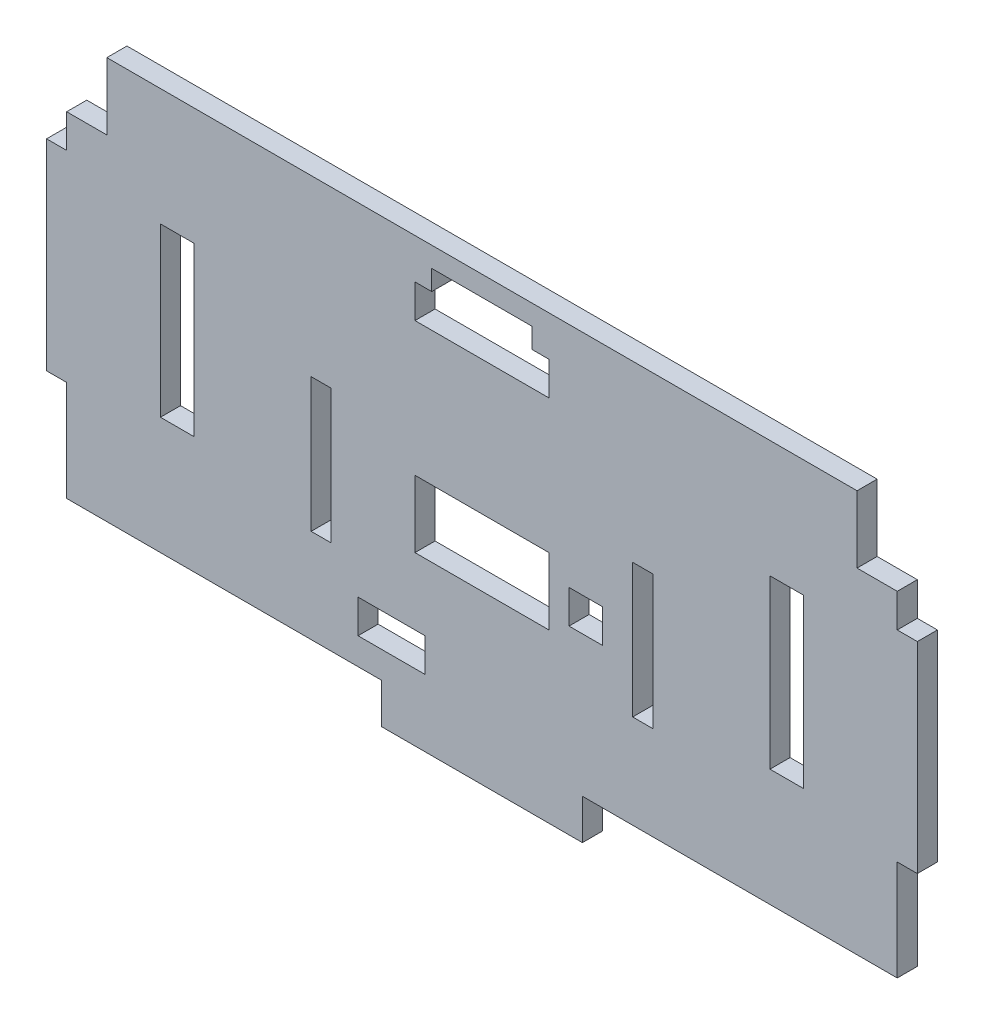
from build123d import *

# Parameters (mm, degrees)
BOSS_EXTRUDE1_DEPTH = 3
SKETCH2_W           = 6
SKETCH2_H           = 10
CUT_EXTRUDE1_DEPTH  = 141.491992654
SKETCH3_W           = 3
SKETCH3_H           = 20
SKETCH3_W_2         = 20
SKETCH3_H_2         = 10
SKETCH3_W_3         = 10
SKETCH3_H_3         = 5
SKETCH3_W_4         = 5
CUT_EXTRUDE2_DEPTH  = 141.491992654
SKETCH4_W           = 5
SKETCH4_H           = 25
CUT_EXTRUDE3_DEPTH  = 141.491992654


with BuildPart() as part:
    # Sketch1 → Boss-Extrude1 (new body)
    with BuildSketch(Plane.XY):
        Polygon((0, 0), (47, 0), (47, -6), (77, -6), (77, 0), (124, 0), (124, 15), (127, 15), (127, 45), (124, 45), (124, 60), (0, 60), (0, 45), (-3, 45), (-3, 15), (0, 15), align=None)
    extrude(amount=BOSS_EXTRUDE1_DEPTH)

    # Sketch2 → Cut-Extrude1 (cut, through all)
    with BuildSketch(Plane.XY.offset(3)):
        with Locations((3, 55)):
            Rectangle(SKETCH2_W, SKETCH2_H)
        with Locations((121, 55)):
            Rectangle(SKETCH2_W, SKETCH2_H)
    extrude(amount=-CUT_EXTRUDE1_DEPTH, mode=Mode.SUBTRACT)

    # Sketch3 → Cut-Extrude2 (cut, through all)
    with BuildSketch(Plane.XY.offset(3)):
        Polygon((54.5, 57), (69.5, 57), (69.5, 54), (72, 54), (72, 49), (52, 49), (52, 54), (54.5, 54), align=None)
        with Locations((38, 24)):
            Rectangle(SKETCH3_W, SKETCH3_H)
        with Locations((86, 24)):
            Rectangle(SKETCH3_W, SKETCH3_H)
        with Locations((62, 24)):
            Rectangle(SKETCH3_W_2, SKETCH3_H_2)
        with Locations((48.5, 6.5)):
            Rectangle(SKETCH3_W_3, SKETCH3_H_3)
        with Locations((77.5, 23.5)):
            Rectangle(SKETCH3_W_4, SKETCH3_H_3)
    extrude(amount=-CUT_EXTRUDE2_DEPTH, mode=Mode.SUBTRACT)

    # Sketch4 → Cut-Extrude3 (cut, through all)
    with BuildSketch(Plane.XY.offset(3)):
        with Locations((16.5, 30)):
            Rectangle(SKETCH4_W, SKETCH4_H)
        with Locations((107.5, 30)):
            Rectangle(SKETCH4_W, SKETCH4_H)
    extrude(amount=-CUT_EXTRUDE3_DEPTH, mode=Mode.SUBTRACT)


solid = part.part
